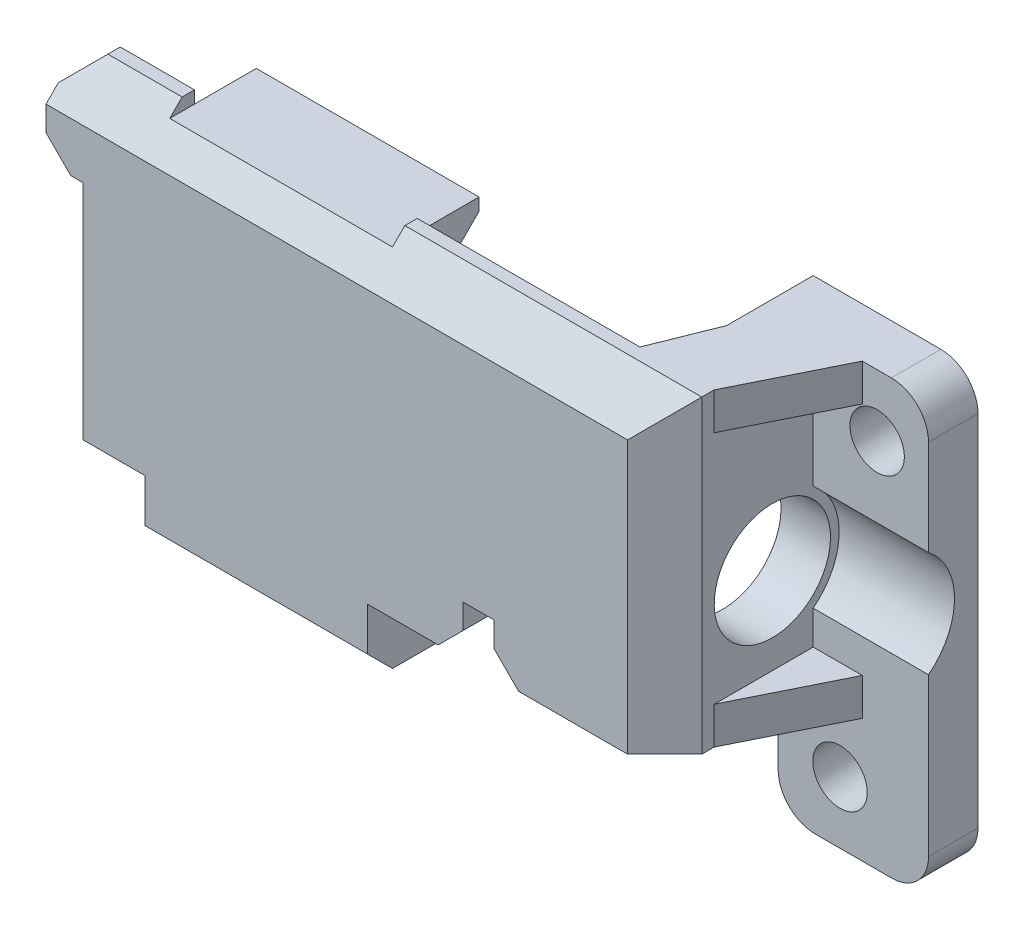
from build123d import *

# Parameters (mm, degrees)
SKETCH_1_R               = 2.2
EXTRUDE_2_DEPTH          = 4
SKETCH_2_W               = 4
SKETCH_2_H               = 25
EXTRUDE_3_DEPTH          = 16
SKETCH_3_W               = 4
SKETCH_3_H               = 25
EXTRUDE_4_DEPTH          = 50
SKETCH_4_W               = 18
SKETCH_4_H               = 6.5
EXTRUDE_5_DEPTH          = 4
SKETCH_5_W               = 18
SKETCH_5_H               = 4
EXTRUDE_6_DEPTH          = 5
SKETCH_6_W               = 2.5
SKETCH_6_H               = 4
SKETCH_6_W_2             = 3
SKETCH_6_H_2             = 18
CUT_EXTRUDE_1_DEPTH      = 4
CUT_EXTRUDE_2_DEPTH      = 64.095166217
CUT_EXTRUDE_2_DEPTH_BACK = 64.095166217
SKETCH_7_R               = 4.7
CUT_EXTRUDE_3_DEPTH      = 64.095166217
EXTRUDE_7_DEPTH          = 3
EXTRUDE_8_DEPTH          = 3
CHAMFER_1_SIZE           = 3
CHAMFER_2_SIZE           = 2
FILLET_1_R               = 3
SKETCH_11_W              = 18
SKETCH_11_H              = 1
CUT_EXTRUDE_4_DEPTH      = 10
FILLET_2_R               = 2


with BuildPart() as part:
    # 草图1 → 凸台-拉伸2 (new body)
    with BuildSketch(Plane.XY):
        Polygon((0, 35), (0, 10), (-2.83, 10), (-2.83, 0), (9.32, 0), (9.32, 35), align=None)
        with Locations((2.17, 5)):
            Circle(SKETCH_1_R, mode=Mode.SUBTRACT)
        with Locations((5.17, 30)):
            Circle(SKETCH_1_R, mode=Mode.SUBTRACT)
    extrude(amount=EXTRUDE_2_DEPTH)

    # 草图2 → 凸台-拉伸3 (add)
    with BuildSketch(Plane(origin=(0, 0, 0), x_dir=(-1, 0, 0), z_dir=(0, 0, -1))):
        with Locations((2, 22.5)):
            Rectangle(SKETCH_2_W, SKETCH_2_H)
    extrude(amount=-EXTRUDE_3_DEPTH)

    # 草图3 → 凸台-拉伸4 (add)
    with BuildSketch(Plane(origin=(0, 0, 0), x_dir=(0, 0, -1), z_dir=(1, 0, 0))):
        with Locations((-14, 22.5)):
            Rectangle(SKETCH_3_W, SKETCH_3_H)
    extrude(amount=-EXTRUDE_4_DEPTH)

    # 草图4 → 凸台-拉伸5 (add)
    with BuildSketch(Plane(origin=(0, 0, 12), x_dir=(-1, 0, 0), z_dir=(0, 0, -1))):
        with Locations((33, 6.75)):
            Rectangle(SKETCH_4_W, SKETCH_4_H)
    extrude(amount=-EXTRUDE_5_DEPTH)

    # 草图5 → 凸台-拉伸6 (add)
    with BuildSketch(Plane(origin=(0, 0, 12), x_dir=(-1, 0, 0), z_dir=(0, 0, -1))):
        with Locations((33, 5.5)):
            Rectangle(SKETCH_5_W, SKETCH_5_H)
        with Locations((33, 33)):
            Rectangle(SKETCH_5_W, SKETCH_5_H)
    extrude(amount=EXTRUDE_6_DEPTH)

    # 草图6 → 切除-拉伸1 (cut)
    with BuildSketch(Plane(origin=(0, 0, 12), x_dir=(-1, 0, 0), z_dir=(0, 0, -1))):
        with Locations((15.05, 12)):
            Rectangle(SKETCH_6_W, SKETCH_6_H)
        with Locations((48.5, 19)):
            Rectangle(SKETCH_6_W_2, SKETCH_6_H_2)
    extrude(amount=-CUT_EXTRUDE_1_DEPTH, mode=Mode.SUBTRACT)

    # 草图7 → 切除-拉伸2 (cut, two sides: drawn at the far end of the back side and taken through both)
    with BuildSketch(Plane(origin=(0, 0, 0), x_dir=(0, 0, -1), z_dir=(1, 0, 0)).offset(-CUT_EXTRUDE_2_DEPTH_BACK)):
        with Locations(Location((-7.3, 20, 0), (0, 0, 45.402043339))):
            Circle(SKETCH_7_R)
    extrude(amount=CUT_EXTRUDE_2_DEPTH + CUT_EXTRUDE_2_DEPTH_BACK, mode=Mode.SUBTRACT)

    # 草图8 → 切除-拉伸3 (cut, through all)
    with BuildSketch(Plane(origin=(0, 0, 0), x_dir=(0, 0, -1), z_dir=(1, 0, 0))):
        with BuildLine():
            Line((-4, 24.274342055), (-4, 23.346640106))
            ThreePointArc((-4, 23.346640106), (-12, 20), (-4, 16.653359894))
            Line((-4, 16.653359894), (-4, 15.725657945))
            ThreePointArc((-4, 15.725657945), (-2.453351674, 17.61882382), (-1.9, 20))
            ThreePointArc((-1.9, 20), (-2.453351674, 22.38117618), (-4, 24.274342055))
        make_face()
        with BuildLine():
            ThreePointArc((-4, 16.653359894), (-12, 20), (-4, 23.346640106))
            Line((-4, 23.346640106), (-4, 24.274342055))
            ThreePointArc((-4, 24.274342055), (-12.7, 20), (-4, 15.725657945))
            Line((-4, 15.725657945), (-4, 16.653359894))
        make_face()
    extrude(amount=CUT_EXTRUDE_3_DEPTH, mode=Mode.SUBTRACT)

    # 草图9 → 凸台-拉伸7 (add)
    with BuildSketch(Plane.XZ.offset(-10)):
        Polygon((3.97, 4), (-0.03, 4), (0, 12), align=None)
        Polygon((-6, 12), (-4, 12), (-4, 7), align=None)
    extrude(amount=-EXTRUDE_7_DEPTH)

    # 草图10 → 凸台-拉伸8 (add)
    with BuildSketch(Plane(origin=(0, 35, 0), x_dir=(1, 0, 0), z_dir=(0, 1, 0))):
        Polygon((3.97, -4), (0, -4), (0, -12), align=None)
        Polygon((-4, -7), (-6, -12), (-4, -12), align=None)
    extrude(amount=-EXTRUDE_8_DEPTH)

    # 倒角1
    chamfer_1_edges = [part.edges().sort_by_distance(p)[0] for p in [
        (0, 22.5, 16),
        (-25, 35, 16),
        (-33, 3.5, 16),
    ]]
    chamfer(chamfer_1_edges, length=CHAMFER_1_SIZE)

    # 倒角2
    chamfer_2_edges = [part.edges().sort_by_distance(p)[0] for p in [
        (-13.8, 10, 14),
        (-16.3, 10, 14),
        (-50, 28, 14),
        (-47, 19, 12),
        (-50, 35, 12.5),
        (-33, 7.5, 7),
        (-33, 31, 7),
    ]]
    chamfer(chamfer_2_edges, length=CHAMFER_2_SIZE)

    # 圆角1
    fillet_1_edges = [part.edges().sort_by_distance(p)[0] for p in [
        (9.32, 35, 2),
        (9.32, 0, 2),
        (-2.83, 0, 2),
    ]]
    fillet(fillet_1_edges, radius=FILLET_1_R)

    # 草图11 → 切除-拉伸4 (cut)
    with BuildSketch(Plane(origin=(0, 0, 7), x_dir=(-1, 0, 0), z_dir=(0, 0, -1))):
        with Locations((33, 34.5)):
            Rectangle(SKETCH_11_W, SKETCH_11_H)
        with Locations((33, 4)):
            Rectangle(SKETCH_11_W, SKETCH_11_H)
    extrude(amount=-CUT_EXTRUDE_4_DEPTH, mode=Mode.SUBTRACT)

    # 圆角2
    fillet_2_edges = [part.edges().sort_by_distance(p)[0] for p in [
        (-33, 7.5, 12),
        (-33, 31, 12),
    ]]
    fillet(fillet_2_edges, radius=FILLET_2_R)


solid = part.part
